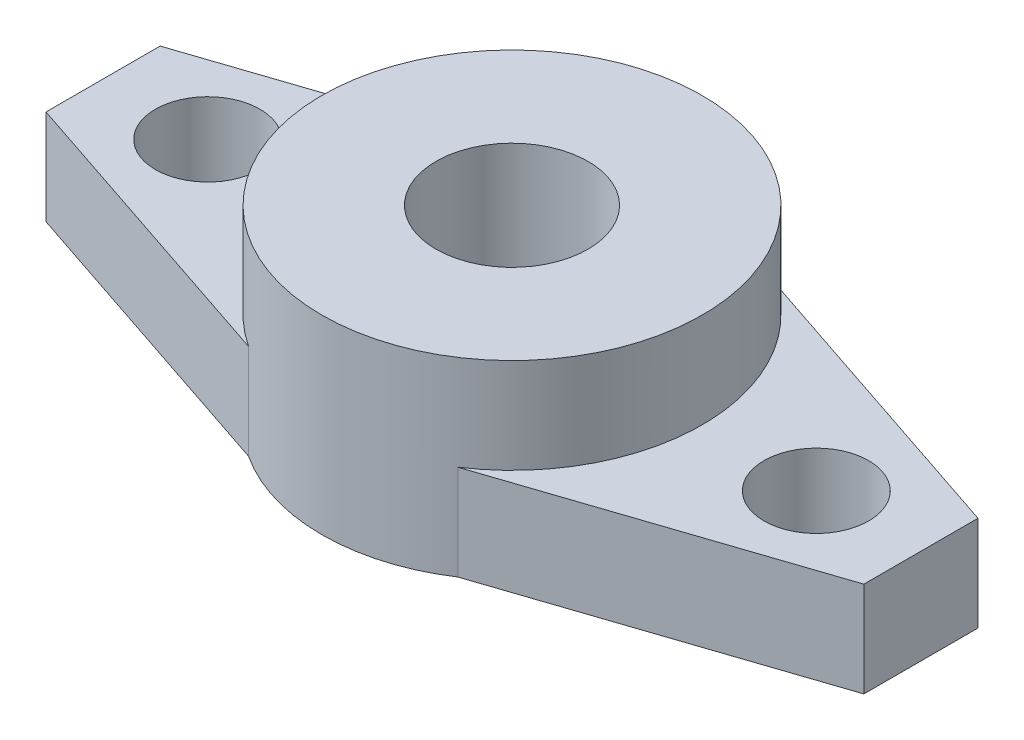
from build123d import *

# Parameters (mm, degrees)
SKETCH1_R             = 2.75
BOSS_EXTRUDE1_DEPTH   = 5
BOSS_EXTRUDE1_2_DEPTH = 5
BOSS_EXTRUDE2_DEPTH   = 10
SKETCH2_R             = 4
CUT_EXTRUDE1_DEPTH    = 26.734218465


with BuildPart() as part:
    # Sketch1 → Boss-Extrude1 (new body)
    with BuildSketch(Plane(origin=(0, 0, 0), x_dir=(1, 0, 0), z_dir=(0, 1, 0))):
        with BuildLine():
            Line((21.5, -3), (21.5, 3))
            Line((21.5, 3), (5.5, 8.351646544))
            ThreePointArc((5.5, 8.351646544), (10, 0), (5.5, -8.351646544))
            Line((5.5, -8.351646544), (21.5, -3))
        make_face()
        with Locations((16, 0)):
            Circle(SKETCH1_R, mode=Mode.SUBTRACT)
    extrude(amount=BOSS_EXTRUDE1_DEPTH)



with BuildPart() as body_2:
    # Sketch1 → Boss-Extrude1 2 (new body)
    with BuildSketch(Plane(origin=(0, 0, 0), x_dir=(1, 0, 0), z_dir=(0, 1, 0))):
        with BuildLine():
            ThreePointArc((-5.5, -8.351646544), (-10, 0), (-5.5, 8.351646544))
            Line((-5.5, 8.351646544), (-21.5, 3))
            Line((-21.5, 3), (-21.5, -3))
            Line((-21.5, -3), (-5.5, -8.351646544))
        make_face()
        with Locations((-16, 0)):
            Circle(SKETCH1_R, mode=Mode.SUBTRACT)
    extrude(amount=BOSS_EXTRUDE1_2_DEPTH)


with BuildPart() as part_1:
    add(part.part)

    add(body_2.part)  # Boss-Extrude2 merges body 2
    # Sketch1<3> → Boss-Extrude2 (add)
    with BuildSketch(Plane(origin=(0, 0, 0), x_dir=(1, 0, 0), z_dir=(0, 1, 0))):
        with BuildLine():
            ThreePointArc((5.5, 8.351646544), (2.870847848, 9.579051761), (3.1e-08, 10))
            ThreePointArc((3.1e-08, 10), (-2.870847818, 9.57905177), (-5.5, 8.351646544))
            ThreePointArc((-5.5, 8.351646544), (-10, 0), (-5.5, -8.351646544))
            ThreePointArc((-5.5, -8.351646544), (-2.870847833, -9.579051765), (0, -10))
            ThreePointArc((0, -10), (2.870847833, -9.579051765), (5.5, -8.351646544))
            ThreePointArc((5.5, -8.351646544), (8.803408431, -4.74341649), (10, 0))
            ThreePointArc((10, 0), (8.803408431, 4.74341649), (5.5, 8.351646544))
        make_face()
    extrude(amount=BOSS_EXTRUDE2_DEPTH)

    # Sketch2 → Cut-Extrude1 (cut, through all)
    with BuildSketch(Plane(origin=(0, 10, 0), x_dir=(1, 0, 0), z_dir=(0, 1, 0))):
        Circle(SKETCH2_R)
    extrude(amount=-CUT_EXTRUDE1_DEPTH, mode=Mode.SUBTRACT)


solid = part_1.part
